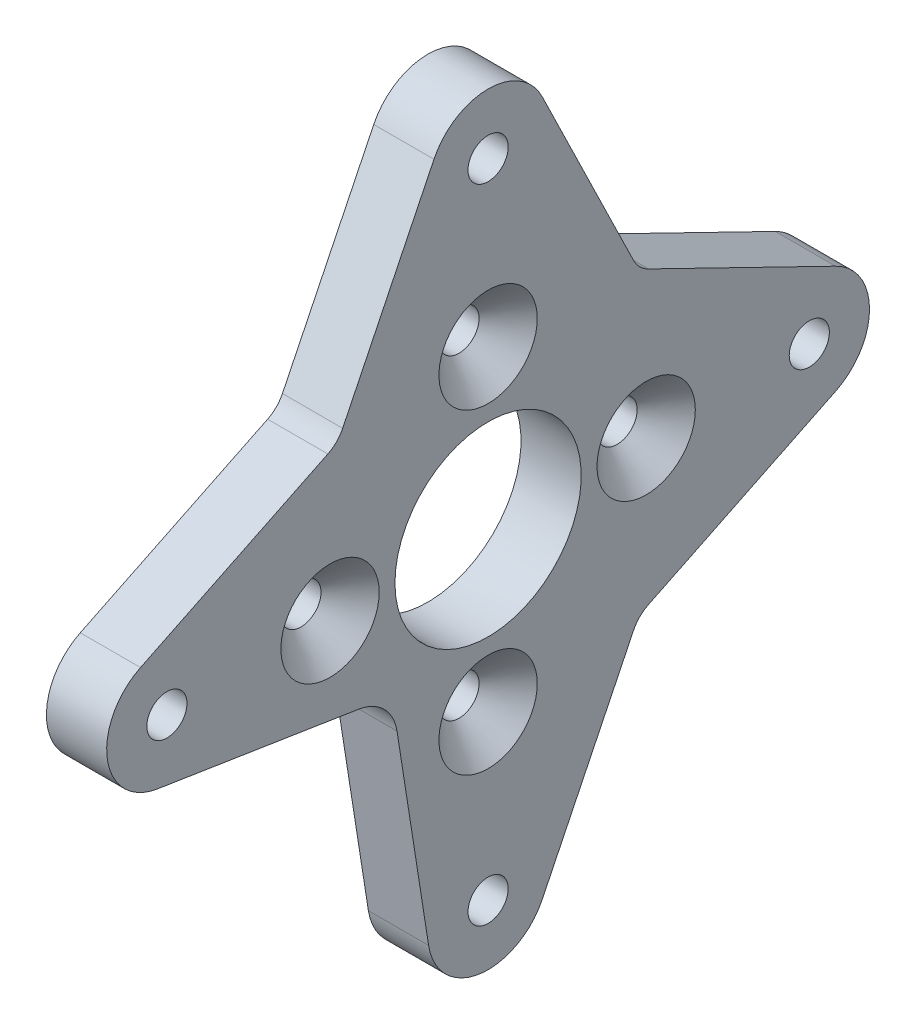
from build123d import *

# Parameters (mm, degrees)
SKETCH1_R           = 7.366
SKETCH1_R_2         = 1.5875
BOSS_EXTRUDE1_DEPTH = 4.7625
CHAMFER1_SIZE       = 2.3


with BuildPart() as part:
    # Sketch1 → Boss-Extrude1 (new body)
    with BuildSketch(Plane(origin=(0, 0, 0), x_dir=(0, 0, -1), z_dir=(1, 0, 0))):
        with BuildLine():
            Line((4.281323883, 27.486066169), (11.500019866, 12.67082398))
            ThreePointArc((11.500019866, 12.67082398), (11.987341379, 11.987341379), (12.67082398, 11.500019866))
            Line((12.67082398, 11.500019866), (27.486066169, 4.281323883))
            ThreePointArc((27.486066169, 4.281323883), (30.1625, 0), (27.486066169, -4.281323883))
            Line((27.486066169, -4.281323883), (12.67082398, -11.500019866))
            ThreePointArc((12.67082398, -11.500019866), (11.987341379, -11.987341379), (11.500019866, -12.67082398))
            Line((11.500019866, -12.67082398), (4.281323883, -27.486066169))
            ThreePointArc((4.281323883, -27.486066169), (-0.706534615, -30.109799899), (-4.704972325, -26.137998423))
            Line((-4.704972325, -26.137998423), (-7.203117872, -10.211533956))
            ThreePointArc((-7.203117872, -10.211533956), (-8.217337882, -8.217337882), (-10.211533956, -7.203117872))
            Line((-10.211533956, -7.203117872), (-26.137998423, -4.704972325))
            ThreePointArc((-26.137998423, -4.704972325), (-30.109799899, -0.706534615), (-27.486066169, 4.281323883))
            Line((-27.486066169, 4.281323883), (-12.67082398, 11.500019866))
            ThreePointArc((-12.67082398, 11.500019866), (-11.987341379, 11.987341379), (-11.500019866, 12.67082398))
            Line((-11.500019866, 12.67082398), (-4.281323883, 27.486066169))
            ThreePointArc((-4.281323883, 27.486066169), (0, 30.1625), (4.281323883, 27.486066169))
        make_face()
        with Locations(Location((0, 0, 0), (0, 0, 180))):
            Circle(SKETCH1_R, mode=Mode.SUBTRACT)
        with Locations(Location((0, 25.4, 0), (0, 0, 180))):
            Circle(SKETCH1_R_2, mode=Mode.SUBTRACT)
        with Locations(Location((0, 12.5, 0), (0, 0, 180))):
            Circle(SKETCH1_R_2, mode=Mode.SUBTRACT)
        with Locations(Location((12.5, 0, 0), (0, 0, 180))):
            Circle(SKETCH1_R_2, mode=Mode.SUBTRACT)
        with Locations(Location((25.4, 0, 0), (0, 0, 180))):
            Circle(SKETCH1_R_2, mode=Mode.SUBTRACT)
        with Locations(Location((0, -12.5, 0), (0, 0, 180))):
            Circle(SKETCH1_R_2, mode=Mode.SUBTRACT)
        with Locations(Location((0, -25.4, 0), (0, 0, 180))):
            Circle(SKETCH1_R_2, mode=Mode.SUBTRACT)
        with Locations(Location((-12.5, 0, 0), (0, 0, 180))):
            Circle(SKETCH1_R_2, mode=Mode.SUBTRACT)
        with Locations(Location((-25.4, 0, 0), (0, 0, 180))):
            Circle(SKETCH1_R_2, mode=Mode.SUBTRACT)
    extrude(amount=BOSS_EXTRUDE1_DEPTH)

    # Chamfer1
    chamfer1_edges = [part.edges().sort_by_distance(p)[0] for p in [
        (4.7625, 0, -14.0875),
        (4.7625, 12.5, -1.5875),
        (4.7625, 0, 10.9125),
        (4.7625, -12.5, -1.5875),
    ]]
    chamfer(chamfer1_edges, length=CHAMFER1_SIZE)


solid = part.part
